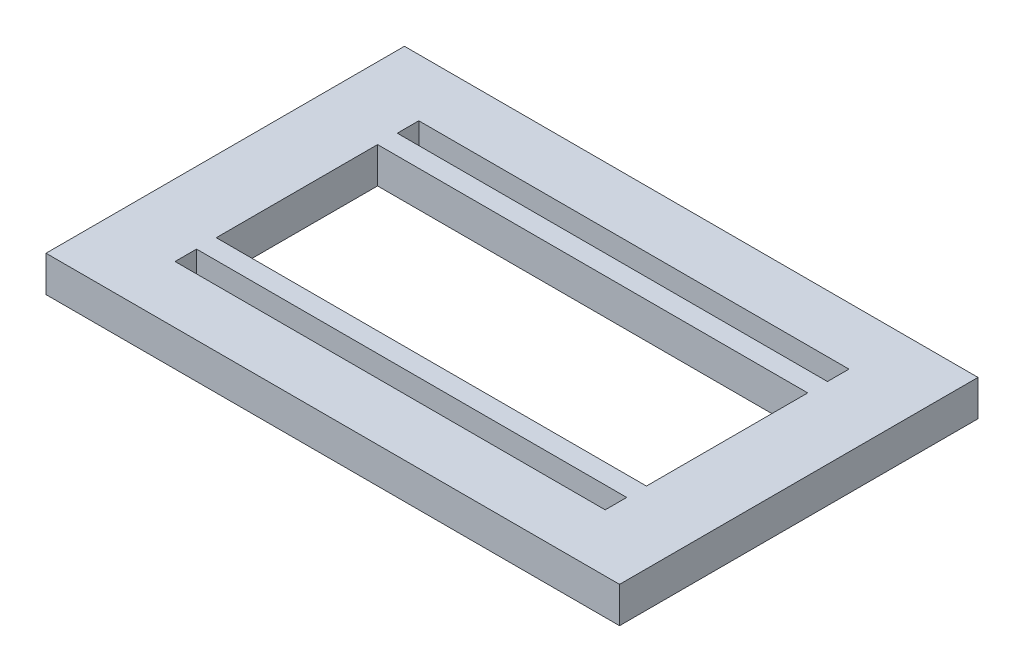
from build123d import *

# Parameters (mm, degrees)
SKETCH1_W           = 80
SKETCH1_H           = 50
SKETCH1_W_2         = 60
SKETCH1_H_2         = 3
SKETCH1_H_3         = 22.5
BOSS_EXTRUDE1_DEPTH = 5


with BuildPart() as part:
    # Sketch1 → Boss-Extrude1 (new body)
    with BuildSketch(Plane(origin=(0, 0, 0), x_dir=(1, 0, 0), z_dir=(0, 1, 0))):
        Rectangle(SKETCH1_W, SKETCH1_H)
        with Locations((0, 15.5)):
            Rectangle(SKETCH1_W_2, SKETCH1_H_2, mode=Mode.SUBTRACT)
        with Locations((0, -15.5)):
            Rectangle(SKETCH1_W_2, SKETCH1_H_2, mode=Mode.SUBTRACT)
        Rectangle(SKETCH1_W_2, SKETCH1_H_3, mode=Mode.SUBTRACT)
    extrude(amount=BOSS_EXTRUDE1_DEPTH)


solid = part.part
